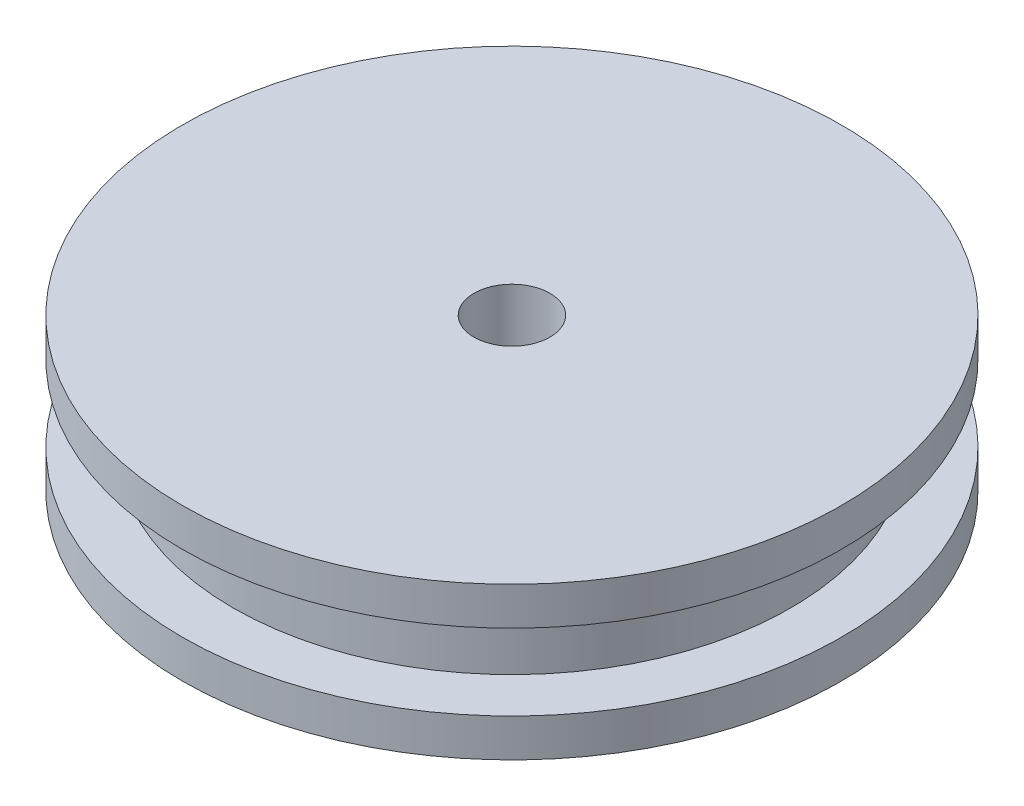
from build123d import *

# Parameters (mm, degrees)
SKETCH4_R          = 9.525
CUT_EXTRUDE1_DEPTH = 123.803155497


with BuildPart() as part:
    # Sketch2 → Revolve1 (revolve)
    with BuildSketch(Plane.XY, mode=Mode.PRIVATE) as revolve1_sk:
        Polygon((0, 16.611620209), (-82.55, 16.611620209), (-82.55, 7.086620209), (-69.85, 7.086620209), (-69.85, -11.963379791), (-82.55, -11.963379791), (-82.55, -21.488379791), (0, -21.488379791), align=None)
    revolve(revolve1_sk.sketch.rotate(Axis((0, 36.56493994, 0), (0, -1, 0)), 270), axis=Axis((0, 36.56493994, 0), (0, -1, 0)))

    # Sketch4 → Cut-Extrude1 (cut, through all)
    with BuildSketch(Plane(origin=(0, 16.611620209, 0), x_dir=(1, 0, 0), z_dir=(0, 1, 0))):
        with Locations(Location((0, 0, 0), (0, 0, 270))):
            Circle(SKETCH4_R)
    extrude(amount=-CUT_EXTRUDE1_DEPTH, mode=Mode.SUBTRACT)


solid = part.part
